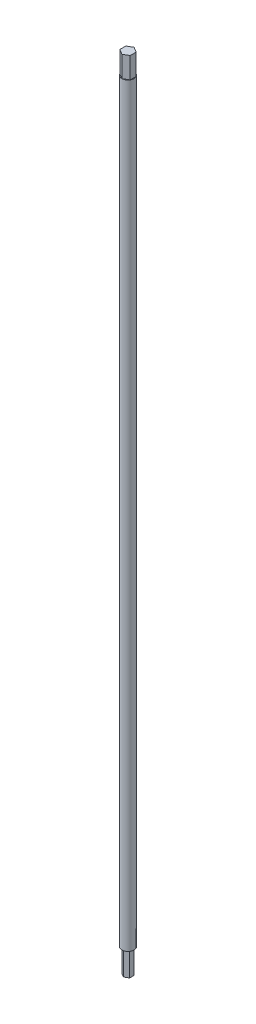
from build123d import *

# Parameters (mm, degrees)
SCHIZZO1_R                   = 2
ESTRUSIONE_ESTRUSIONE1_DEPTH = 250
ESTRUSIONE_ESTRUSIONE2_DEPTH = 8
ESTRUSIONE_ESTRUSIONE3_DEPTH = 7


with BuildPart() as part:
    # Schizzo1 → Estrusione-Estrusione1 (new body)
    with BuildSketch(Plane(origin=(0, 0, 0), x_dir=(1, 0, 0), z_dir=(0, 1, 0))):
        with Locations(Location((0, 0, 0), (0, 0, 270))):
            Circle(SCHIZZO1_R)
    extrude(amount=ESTRUSIONE_ESTRUSIONE1_DEPTH)

    # Schizzo2 → Estrusione-Estrusione2 (add)
    with BuildSketch(Plane.XZ):
        Polygon((0, 1.5), (-1.299038106, 0.75), (-1.299038106, -0.75), (0, -1.5), (1.299038106, -0.75), (1.299038106, 0.75), align=None)
    extrude(amount=ESTRUSIONE_ESTRUSIONE2_DEPTH)

    # Schizzo3 → Estrusione-Estrusione3 (add)
    with BuildSketch(Plane(origin=(0, 250, 0), x_dir=(1, 0, 0), z_dir=(0, 1, 0))):
        Polygon((0, 2), (-1.732050808, 1), (-1.732050808, -1), (0, -2), (1.732050808, -1), (1.732050808, 1), align=None)
    extrude(amount=ESTRUSIONE_ESTRUSIONE3_DEPTH)


solid = part.part
